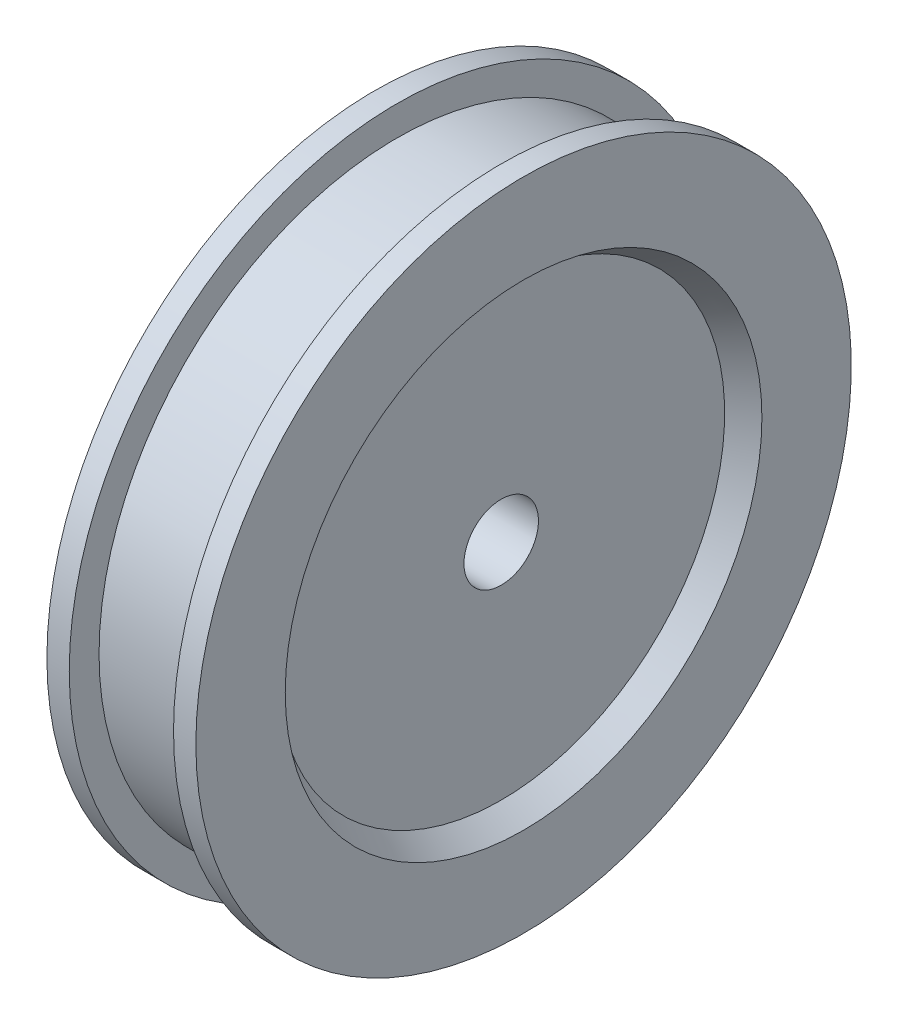
from build123d import *


with BuildPart() as part:
    # Sketch1 → Revolve1 (revolve)
    with BuildSketch(Plane.XY, mode=Mode.PRIVATE) as revolve1_sk:
        Polygon((-7, 40), (7, 40), (7, 44), (10, 44), (10, 32), (7, 30), (7, 5), (-7, 5), (-7, 30), (-10, 32), (-10, 44), (-7, 44), align=None)
    revolve(revolve1_sk.sketch.rotate(Axis((0, 0, 0), (1, 0, 0)), 90), axis=Axis((0, 0, 0), (1, 0, 0)))


solid = part.part
